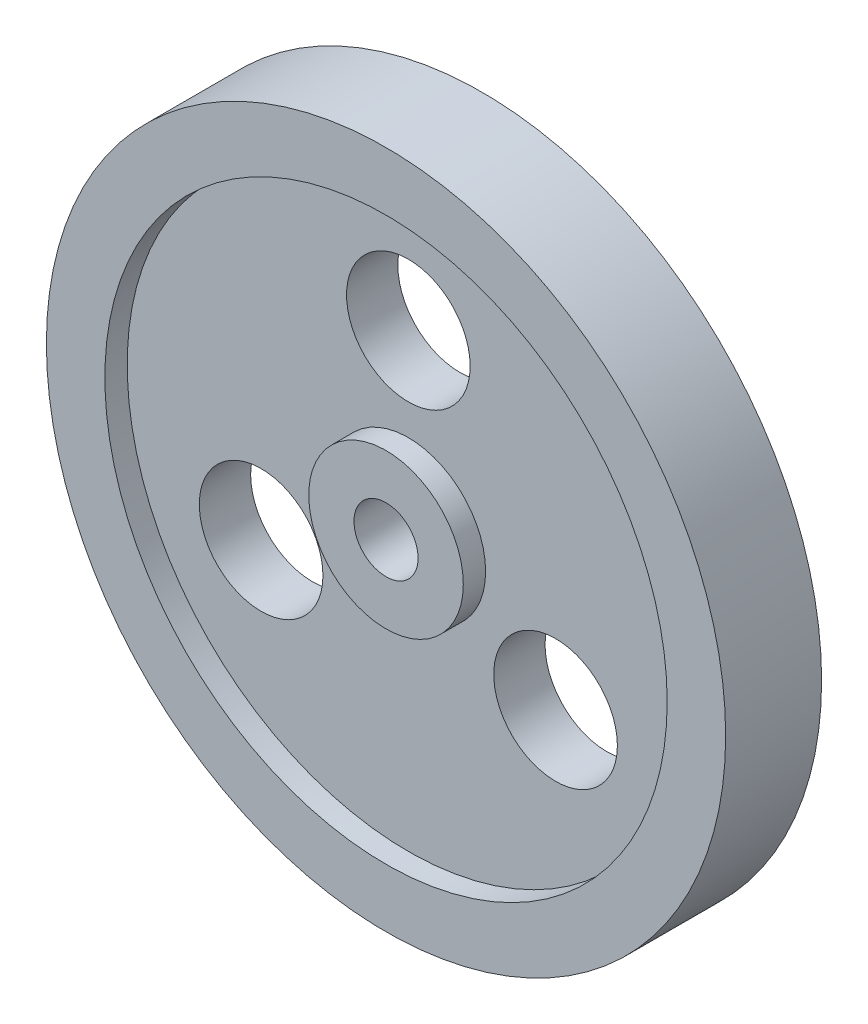
from build123d import *

# Parameters (mm, degrees)
SKETCH1_R           = 19.78095238
SKETCH1_R_2         = 1.8669
BOSS_EXTRUDE1_DEPTH = 2.794
SKETCH2_R           = 16.375
SKETCH2_R_2         = 4.5
CUT_EXTRUDE1_DEPTH  = 1.3
SKETCH3_R           = 3.6
CUT_EXTRUDE2_DEPTH  = 29.301220789


with BuildPart() as part:
    # Sketch1 → Boss-Extrude1 (new, symmetric)
    with BuildSketch(Plane.XY):
        Circle(SKETCH1_R)
        Circle(SKETCH1_R_2, mode=Mode.SUBTRACT)
    extrude(amount=BOSS_EXTRUDE1_DEPTH, both=True)

    # Sketch2 → Cut-Extrude1 (cut)
    with BuildSketch(Plane.XY.offset(2.794)):
        Circle(SKETCH2_R)
        Circle(SKETCH2_R_2, mode=Mode.SUBTRACT)
    cut_extrude1 = extrude(amount=-CUT_EXTRUDE1_DEPTH, mode=Mode.SUBTRACT)

    # Mirror1: Cut-Extrude1 across plane
    add(cut_extrude1.mirror(Plane.XY), mode=Mode.SUBTRACT)

    # Sketch3 → Cut-Extrude2 (cut, through all)
    with BuildSketch(Plane.XY.offset(1.494)):
        with Locations((0, 9.9)):
            Circle(SKETCH3_R)
        with Locations((8.573651497, -4.95)):
            Circle(SKETCH3_R)
        with Locations((-8.573651497, -4.95)):
            Circle(SKETCH3_R)
    extrude(amount=-CUT_EXTRUDE2_DEPTH, mode=Mode.SUBTRACT)


solid = part.part
